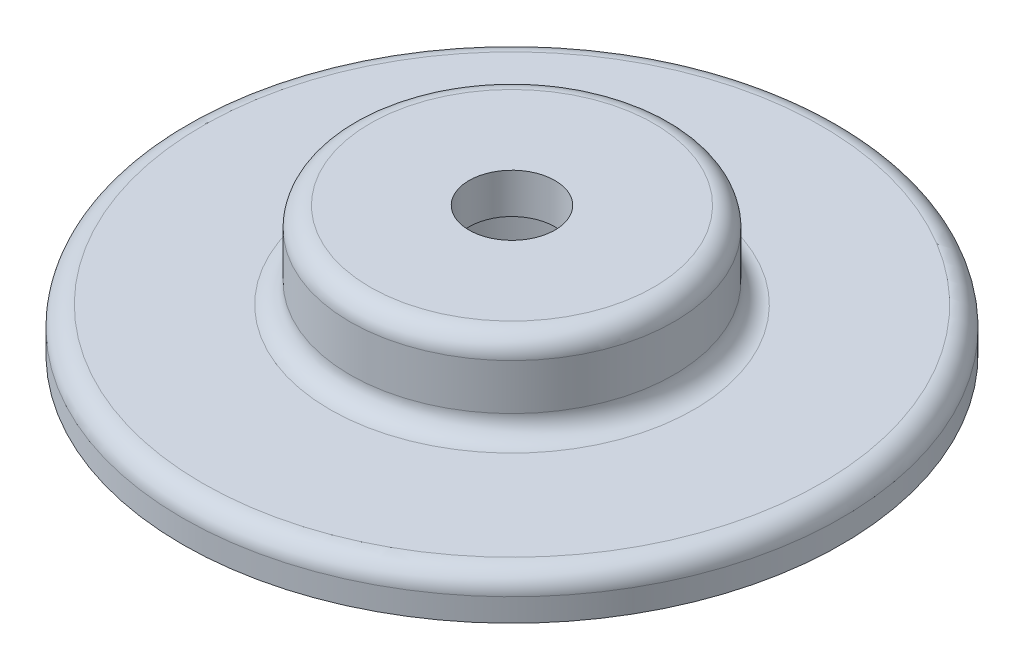
from build123d import *

# Parameters (mm, degrees)
SKETCH1_R           = 11.5
BOSS_EXTRUDE1_DEPTH = 4.5
SKETCH2_R           = 3.65
CUT_EXTRUDE1_DEPTH  = 3.1
SKETCH3_R           = 1.5
CUT_EXTRUDE2_DEPTH  = 17.556267695
CUT_EXTRUDE4_START  = -3
SKETCH4_R           = 11.5
SKETCH4_R_2         = 5.65
CUT_EXTRUDE4_DEPTH  = 3
FILLET2_R           = 0.7


with BuildPart() as part:
    # Sketch1 → Boss-Extrude1 (new body)
    with BuildSketch(Plane(origin=(0, 0, 0), x_dir=(1, 0, 0), z_dir=(0, 1, 0))):
        with Locations(Location((0, 0, 0), (0, 0, 270))):
            Circle(SKETCH1_R)
    extrude(amount=BOSS_EXTRUDE1_DEPTH)

    # Sketch2 → Cut-Extrude1 (cut)
    with BuildSketch(Plane.XZ):
        with Locations(Location((0, 0, 0), (0, 0, 270))):
            Circle(SKETCH2_R)
    extrude(amount=-CUT_EXTRUDE1_DEPTH, mode=Mode.SUBTRACT)

    # Sketch3 → Cut-Extrude2 (cut, through all)
    with BuildSketch(Plane.XZ.offset(-3.1)):
        with Locations(Location((0, 0, 0), (0, 0, 270))):
            Circle(SKETCH3_R)
    extrude(amount=-CUT_EXTRUDE2_DEPTH, mode=Mode.SUBTRACT)

    # Sketch4 → Cut-Extrude4 (cut)
    with BuildSketch(Plane(origin=(0, 4.5, 0), x_dir=(1, 0, 0), z_dir=(0, 1, 0)).offset(CUT_EXTRUDE4_START)):
        with Locations(Location((0, 0, 0), (0, 0, 270))):
            Circle(SKETCH4_R)
        with Locations(Location((0, 0, 0), (0, 0, 270))):
            Circle(SKETCH4_R_2, mode=Mode.SUBTRACT)
    extrude(amount=CUT_EXTRUDE4_DEPTH, mode=Mode.SUBTRACT)

    # Fillet2
    fillet2_edges = [part.edges().sort_by_distance(p)[0] for p in [
        (0, 1.5, -11.5),
        (0, 1.5, -5.65),
        (0, 4.5, -5.65),
    ]]
    fillet(fillet2_edges, radius=FILLET2_R)


solid = part.part
